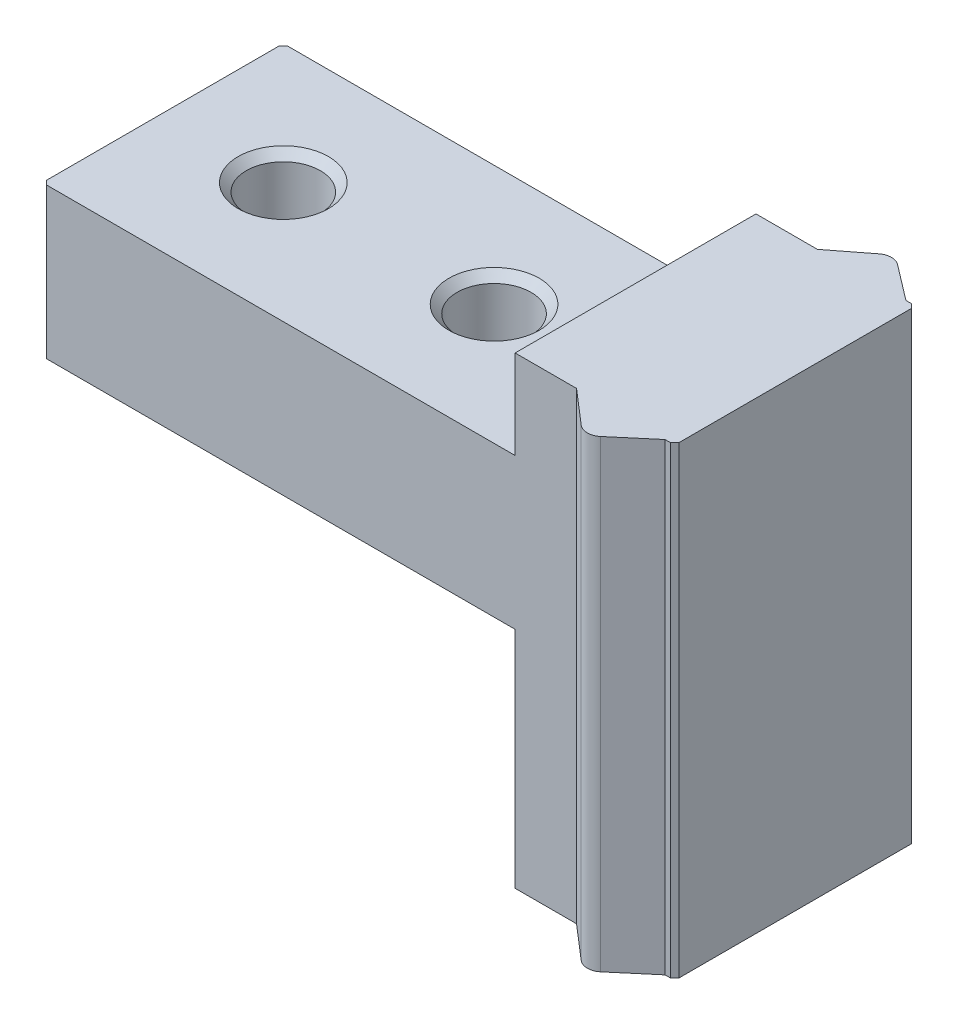
from build123d import *

# Parameters (mm, degrees)
BOSS_EXTRUDE1_DEPTH = 15.4
BOSS_EXTRUDE2_DEPTH = 5
SCALE_1_SCALE       = 2.5


with BuildPart() as part:
    # Sketch1 → Boss-Extrude1 (new body)
    with BuildSketch(Plane(origin=(0, 3, 0), x_dir=(1, 0, 0), z_dir=(0, 1, 0))):
        with BuildLine():
            Line((-51.8, -4), (-49.76, -4))
            Line((-49.76, -4), (-48.626761605, -4.978453238))
            ThreePointArc((-48.626761605, -4.978453238), (-48.302157504, -5.099995345), (-47.97651659, -4.981259077))
            Line((-47.97651659, -4.981259077), (-46.82, -4))
            Line((-46.82, -4), (-46.641421356, -4))
            Line((-46.641421356, -4), (-46.5, -3.858578644))
            Line((-46.5, -3.858578644), (-46.5, 3.858578644))
            Line((-46.5, 3.858578644), (-46.641421356, 4))
            Line((-46.641421356, 4), (-46.82, 4))
            Line((-46.82, 4), (-47.996771021, 4.897557777))
            ThreePointArc((-47.996771021, 4.897557777), (-48.302073982, 4.999995699), (-48.606516627, 4.895028552))
            Line((-48.606516627, 4.895028552), (-49.76, 4))
            Line((-49.76, 4), (-51.8, 4))
            Line((-51.8, 4), (-51.8, -4))
        make_face()
    extrude(amount=BOSS_EXTRUDE1_DEPTH)

    # Sketch2 → Boss-Extrude2 (add)
    with BuildSketch(Plane(origin=(0, 10.45, 0), x_dir=(1, 0, 0), z_dir=(0, 1, 0))):
        Polygon((-67.5, 3.858578644), (-67.5, -3.858578644), (-67.358578644, -4), (-51.8, -4), (-51.8, 4), (-67.358578644, 4), align=None)
    extrude(amount=BOSS_EXTRUDE2_DEPTH)

    # Sketch3 → Cut-Revolve1 (revolve, cut)
    with BuildSketch(Plane.XY):
        Polygon((-63.5, 10.44), (-65, 10.44), (-64.7295, 10.7105), (-64.7295, 15.1795), (-65, 15.45), (-63.5, 15.45), align=None)
    revolve(axis=Axis((-63.5, 15.45, 0), (0, -1, 0)), mode=Mode.SUBTRACT)

    # Sketch4 → Cut-Revolve2 (revolve, cut)
    with BuildSketch(Plane.XY):
        Polygon((-56.5, 10.44), (-58, 10.44), (-57.7295, 10.7105), (-57.7295, 15.1795), (-58, 15.45), (-56.5, 15.45), align=None)
    revolve(axis=Axis((-56.5, 15.45, 0), (0, -1, 0)), mode=Mode.SUBTRACT)


with BuildPart() as part_1:
    # 缩放比例1: scaled about (-53.834630524, 11.714177537, 0.010190259)
    add(part.part.scale(SCALE_1_SCALE).moved(Location((80.751945786, -17.571266306, -0.015285389))))


solid = part_1.part
